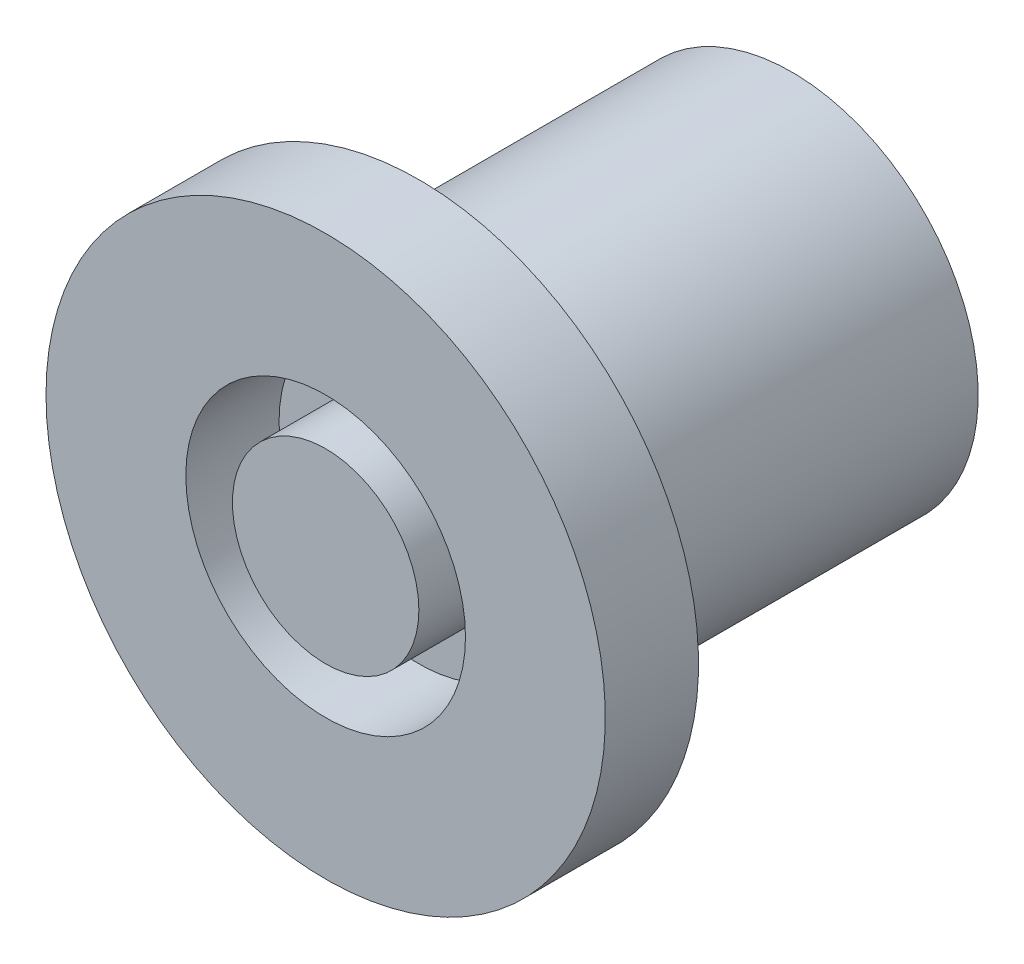
from build123d import *

# Parameters (mm, degrees)
SKETCH1_R           = 1
BOSS_EXTRUDE1_DEPTH = 2
SKETCH2_R           = 1.5
BOSS_EXTRUDE2_DEPTH = 0.5
SKETCH3_R           = 0.75
SKETCH3_R_2         = 0.5
CUT_EXTRUDE1_DEPTH  = 0.5


with BuildPart() as part:
    # Sketch1 → Boss-Extrude1 (new body)
    with BuildSketch(Plane.XY):
        Circle(SKETCH1_R)
    extrude(amount=BOSS_EXTRUDE1_DEPTH)

    # Sketch2 → Boss-Extrude2 (add)
    with BuildSketch(Plane.XY.offset(2)):
        Circle(SKETCH2_R)
    extrude(amount=BOSS_EXTRUDE2_DEPTH)

    # Sketch3 → Cut-Extrude1 (cut)
    with BuildSketch(Plane.XY.offset(2.5)):
        Circle(SKETCH3_R)
        Circle(SKETCH3_R_2, mode=Mode.SUBTRACT)
    extrude(amount=-CUT_EXTRUDE1_DEPTH, mode=Mode.SUBTRACT)


solid = part.part
